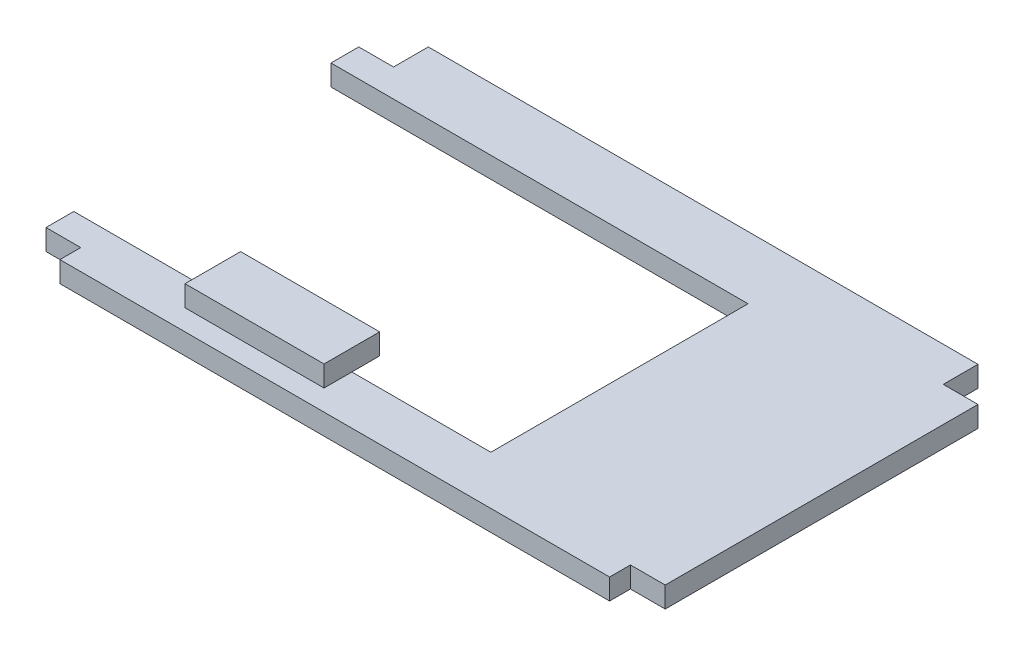
from build123d import *

# Parameters (mm, degrees)
ESTRUSIONE_ESTRUSIONE1_DEPTH      = 48
ESTRUSIONE_ESTRUSIONE1_DEPTH_BACK = 5
SCHIZZO1_W                        = 79.084596206
SCHIZZO1_H                        = 3
SCHIZZO2_W                        = 45
SCHIZZO2_H                        = 3
ESTRUSIONE_ESTRUSIONE2_DEPTH      = 5
SCHIZZO3_W                        = 60
SCHIZZO3_H                        = 37
TAGLIO_ESTRUSIONE1_DEPTH          = 10
SCHIZZO4_W                        = 20
SCHIZZO4_H                        = 8
ESTRUSIONE_ESTRUSIONE3_DEPTH      = 3


with BuildPart() as part:
    # Schizzo1 → Estrusione-Estrusione1 (new, two sides: drawn at the far end of the back side and taken through both)
    with BuildSketch(Plane.XY.offset(-ESTRUSIONE_ESTRUSIONE1_DEPTH_BACK)):
        with Locations((119.542298103, -82.5)):
            Rectangle(SCHIZZO1_W, SCHIZZO1_H)
    extrude(amount=ESTRUSIONE_ESTRUSIONE1_DEPTH + ESTRUSIONE_ESTRUSIONE1_DEPTH_BACK)

    # Schizzo2 → Estrusione-Estrusione2 (add)
    with BuildSketch(Plane(origin=(159.084596206, 0, 0), x_dir=(0, 0, -1), z_dir=(1, 0, 0))):
        with Locations((-22.5, -82.5)):
            Rectangle(SCHIZZO2_W, SCHIZZO2_H)
    estrusione_estrusione2 = extrude(amount=ESTRUSIONE_ESTRUSIONE2_DEPTH)

    # Specchia1: Estrusione-Estrusione2 across plane
    add(estrusione_estrusione2.mirror(Plane(origin=(119.542298103, 0, 0), x_dir=(0, 0, 1), z_dir=(1, 0, 0))))

    # Schizzo3 → Taglio-Estrusione1 (cut)
    with BuildSketch(Plane(origin=(0, -81, 0), x_dir=(1, 0, 0), z_dir=(0, 1, 0))):
        with Locations((105, -22.5)):
            Rectangle(SCHIZZO3_W, SCHIZZO3_H)
    extrude(amount=-TAGLIO_ESTRUSIONE1_DEPTH, mode=Mode.SUBTRACT)

    # Schizzo4 → Estrusione-Estrusione3 (add)
    with BuildSketch(Plane.XZ.offset(81)):
        with Locations((105, 41)):
            Rectangle(SCHIZZO4_W, SCHIZZO4_H)
    extrude(amount=-ESTRUSIONE_ESTRUSIONE3_DEPTH)


solid = part.part
